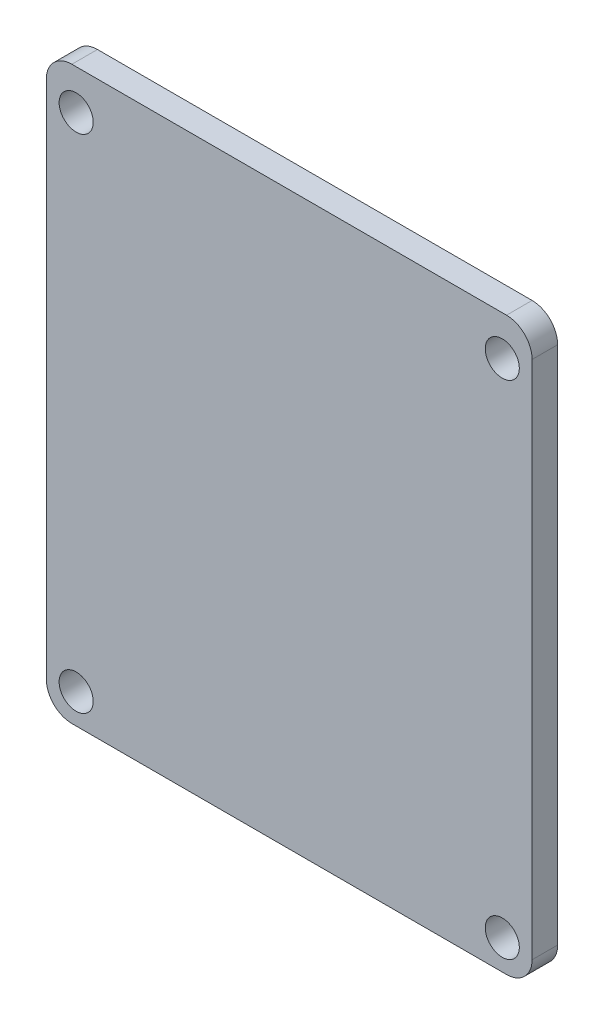
from build123d import *

# Parameters (mm, degrees)
SKICA1_W                = 57
SKICA1_H                = 67
SKICA1_R                = 2
P_IDAT_VYSUNUT_M1_DEPTH = 3
P_IDAT_VYSUNUT_M2_DEPTH = 1
ZAOBLIT1_R              = 3


with BuildPart() as part:
    # Skica1 → Přidat vysunutím1 (new body)
    with BuildSketch(Plane.XY):
        with Locations((28.5, 33.5)):
            Rectangle(SKICA1_W, SKICA1_H)
        with Locations((3.5, 62.35016579)):
            Circle(SKICA1_R, mode=Mode.SUBTRACT)
        with Locations((53.5, 62.35016579)):
            Circle(SKICA1_R, mode=Mode.SUBTRACT)
        with Locations((53.5, 3.5)):
            Circle(SKICA1_R, mode=Mode.SUBTRACT)
        with Locations((3.5, 3.5)):
            Circle(SKICA1_R, mode=Mode.SUBTRACT)
    extrude(amount=P_IDAT_VYSUNUT_M1_DEPTH)

    # Skica2 → Přidat vysunutím2 (add)
    with BuildSketch(Plane(origin=(0, 0, 0), x_dir=(-1, 0, 0), z_dir=(0, 0, -1))):
        with BuildLine():
            Line((-37.970657991, 29.469714485), (-37.970657991, 33.391990126))
            add(Edge.make_bspline(
                [(-37.970657991, 33.391990126), (-37.970361441, 33.661766733), (-37.969793238, 34.178670691), (-37.952566119, 34.919899581), (-37.92955645, 35.593098048), (-37.897659918, 36.19681451), (-37.859965116, 36.732906499), (-37.80709632, 37.198948211), (-37.751894631, 37.598602818), (-37.695772308, 37.838068244), (-37.670177222, 37.947278587)],
                knots=[0, 0, 0, 0, 1.415646017, 2.712440637, 3.8905458, 4.950247383, 5.884950622, 6.709939814, 7.411656543, 8, 8, 8, 8], degree=3))
            add(Edge.make_bspline(
                [(-37.670177222, 37.947278587), (-37.632336028, 38.085526146), (-37.557545321, 38.358763633), (-37.407774038, 38.752501326), (-37.230082137, 39.12702996), (-37.027953627, 39.484021162), (-36.791438809, 39.8169729), (-36.53627201, 40.136984307), (-36.245963268, 40.432759), (-35.929669008, 40.708303209), (-35.591400822, 40.962981078), (-35.22501281, 41.176956538), (-34.841443644, 41.364050016), (-34.435480303, 41.51723294), (-34.006728651, 41.631146127), (-33.558235665, 41.715715192), (-33.089497036, 41.76963955), (-32.769150626, 41.774786619), (-32.606074658, 41.777406793)],
                knots=[0, 0, 0, 0, 0.999549623, 1.97554611, 2.93413192, 3.889860808, 4.833293765, 5.780583482, 6.742559327, 7.719844669, 8.705620613, 9.691528643, 10.674968152, 11.680406189, 12.713313868, 13.765869198, 14.862690416, 16, 16, 16, 16], degree=3))
            add(Edge.make_bspline(
                [(-32.606074658, 41.777406793), (-32.441630219, 41.774998651), (-32.119883568, 41.77028696), (-31.649181921, 41.713736758), (-31.199362549, 41.637564235), (-30.771422832, 41.520438221), (-30.367904143, 41.367034375), (-29.982639961, 41.187079788), (-29.622184693, 40.970031043), (-29.285229735, 40.720632016), (-28.971458808, 40.443194333), (-28.683145696, 40.13889183), (-28.421978048, 39.808953015), (-28.18737037, 39.454426455), (-27.984763059, 39.07185589), (-27.803292745, 38.667043584), (-27.650886684, 38.236470919), (-27.570714904, 37.938513696), (-27.529952863, 37.787022177)],
                knots=[0, 0, 0, 0, 1.121902311, 2.195077645, 3.232258892, 4.234102512, 5.217864754, 6.176164875, 7.132989551, 8.084763148, 9.034132444, 9.988522005, 10.94243251, 11.903244335, 12.886203696, 13.894208494, 14.929344452, 16, 16, 16, 16], degree=3))
            add(Edge.make_bspline(
                [(-27.529952863, 37.787022177), (-27.503327115, 37.661721699), (-27.44497524, 37.387118416), (-27.379389367, 36.934902646), (-27.325601784, 36.408121947), (-27.275406782, 35.808568661), (-27.248809706, 35.134844643), (-27.2175804, 34.388495093), (-27.202844998, 33.566994114), (-27.201913537, 32.994022793), (-27.201427222, 32.694874741)],
                knots=[0, 0, 0, 0, 0.601372724, 1.317943291, 2.144091499, 3.08771165, 4.142394186, 5.309582461, 6.595334295, 8, 8, 8, 8], degree=3))
            Line((-27.201427222, 32.694874741), (-27.201427222, 31.26458628))
            Line((-27.201427222, 31.26458628), (-17.970657991, 31.26458628))
            Line((-17.970657991, 31.26458628), (-17.970657991, 29.469714485))
            Line((-17.970657991, 29.469714485), (-37.970657991, 29.469714485))
        make_face()
        with BuildLine():
            Line((-35.91937594, 31.26458628), (-29.252709273, 31.26458628))
            Line((-29.252709273, 31.26458628), (-29.20863876, 34.766188844))
            add(Edge.make_bspline(
                [(-29.20863876, 34.766188844), (-29.208544615, 34.937161044), (-29.208362868, 35.267219352), (-29.231212915, 35.74398178), (-29.257239208, 36.186374829), (-29.296602466, 36.592734917), (-29.348201463, 36.964487883), (-29.412369977, 37.298422688), (-29.482131358, 37.599533869), (-29.59868532, 37.945903952), (-29.777898997, 38.335235337), (-30.038784485, 38.760550157), (-30.376749174, 39.118208289), (-30.755679044, 39.427140639), (-31.176087647, 39.677123759), (-31.628265809, 39.853476877), (-32.105514558, 39.962067848), (-32.431886932, 39.97562982), (-32.598061837, 39.982534998)],
                knots=[0, 0, 0, 0, 1.160746174, 2.240796558, 3.240300023, 4.169675897, 5.012224395, 5.787635701, 6.478238024, 7.109103438, 8.265591281, 9.382545711, 10.479929969, 11.588830844, 12.694575677, 13.785760505, 14.872603606, 16, 16, 16, 16], degree=3))
            add(Edge.make_bspline(
                [(-32.598061837, 39.982534998), (-32.758853186, 39.975319803), (-33.078486486, 39.96097689), (-33.546938864, 39.854373012), (-33.99399119, 39.675230054), (-34.411014182, 39.42692209), (-34.789110253, 39.125487049), (-35.118120247, 38.775412024), (-35.380842639, 38.375801415), (-35.556946227, 38.007170082), (-35.66004866, 37.677065259), (-35.734515791, 37.39175206), (-35.785866012, 37.067954947), (-35.835001767, 36.708750483), (-35.874664128, 36.314594731), (-35.902207185, 35.882982532), (-35.918157543, 35.415351195), (-35.918959975, 35.090720886), (-35.91937594, 34.922438844)],
                knots=[0, 0, 0, 0, 1.120540835, 2.227496496, 3.330685923, 4.466139262, 5.598993257, 6.692710361, 7.80064471, 8.921224235, 9.527843361, 10.209888745, 10.975318552, 11.811557897, 12.738105936, 13.73658638, 14.826690375, 16, 16, 16, 16], degree=3))
            Line((-35.91937594, 34.922438844), (-35.91937594, 31.26458628))
        make_face(mode=Mode.SUBTRACT)
    extrude(amount=P_IDAT_VYSUNUT_M2_DEPTH)

    # Zaoblit1
    zaoblit1_edges = [part.edges().sort_by_distance(p)[0] for p in [
        (0, 67, 1.5),
        (57, 67, 1.5),
        (57, 0, 1.5),
        (0, 0, 1.5),
    ]]
    fillet(zaoblit1_edges, radius=ZAOBLIT1_R)


solid = part.part
